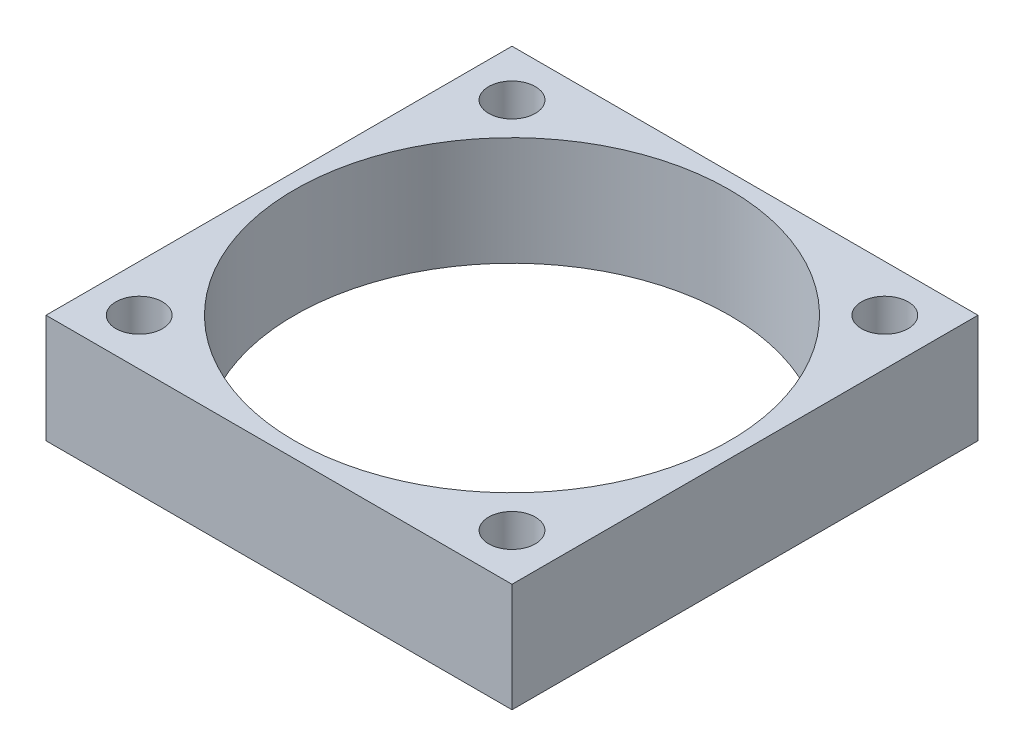
from build123d import *

# Parameters (mm, degrees)
SKETCH_1_W      = 30
SKETCH_1_H      = 30
SKETCH_1_R      = 1.5
SKETCH_1_R_2    = 14
EXTRUDE_1_DEPTH = 7


with BuildPart() as part:
    # 草图1 → 凸台-拉伸1 (new body)
    with BuildSketch(Plane(origin=(0, 0, 0), x_dir=(1, 0, 0), z_dir=(0, 1, 0))):
        with Locations((1.16, 0.76)):
            Rectangle(SKETCH_1_W, SKETCH_1_H)
        with Locations(Location((-10.84, 12.76, 0), (0, 0, 270))):
            Circle(SKETCH_1_R, mode=Mode.SUBTRACT)
        with Locations(Location((-10.84, -11.24, 0), (0, 0, 270))):
            Circle(SKETCH_1_R, mode=Mode.SUBTRACT)
        with Locations(Location((13.16, -11.24, 0), (0, 0, 270))):
            Circle(SKETCH_1_R, mode=Mode.SUBTRACT)
        with Locations(Location((13.16, 12.76, 0), (0, 0, 270))):
            Circle(SKETCH_1_R, mode=Mode.SUBTRACT)
        with Locations(Location((1.16, 0.76, 0), (0, 0, 270))):
            Circle(SKETCH_1_R_2, mode=Mode.SUBTRACT)
    extrude(amount=EXTRUDE_1_DEPTH)


solid = part.part
